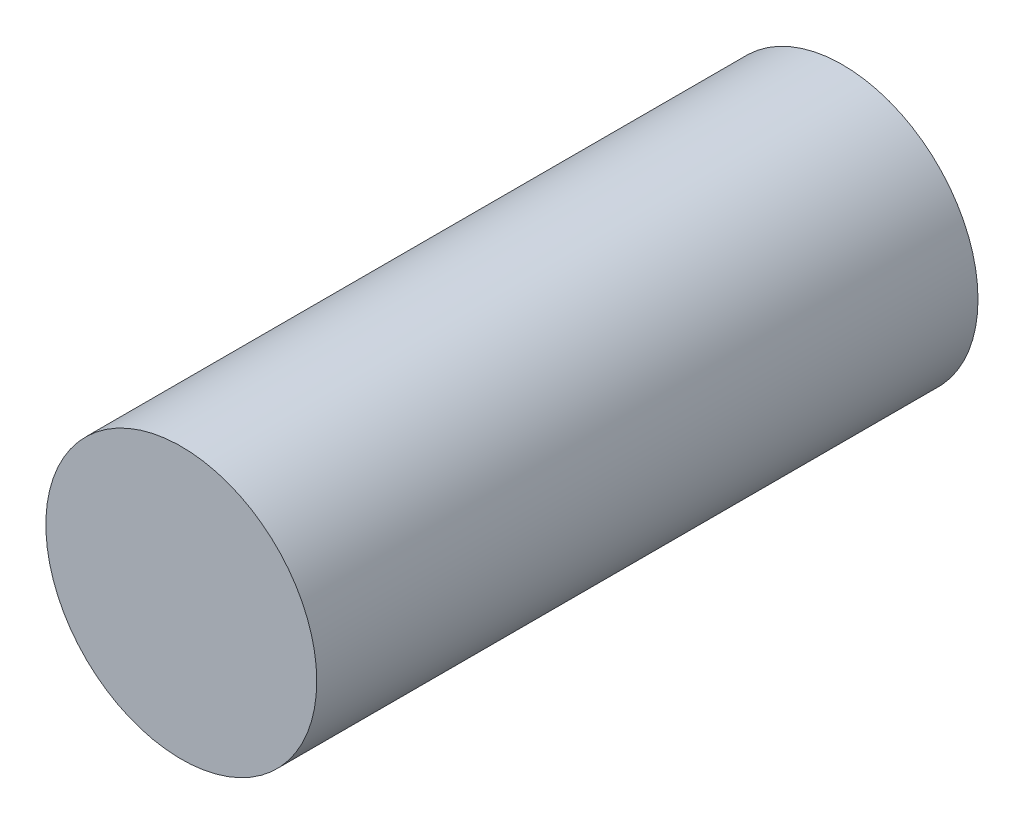
from build123d import *

# Parameters (mm, degrees)
SKETCH1_R          = 1209.806435856
NACELLE_BODY_DEPTH = 5906.114982768


with BuildPart() as part:
    # Sketch1 → Nacelle body (new body)
    with BuildSketch(Plane.XY):
        Circle(SKETCH1_R)
    extrude(amount=NACELLE_BODY_DEPTH)


solid = part.part
